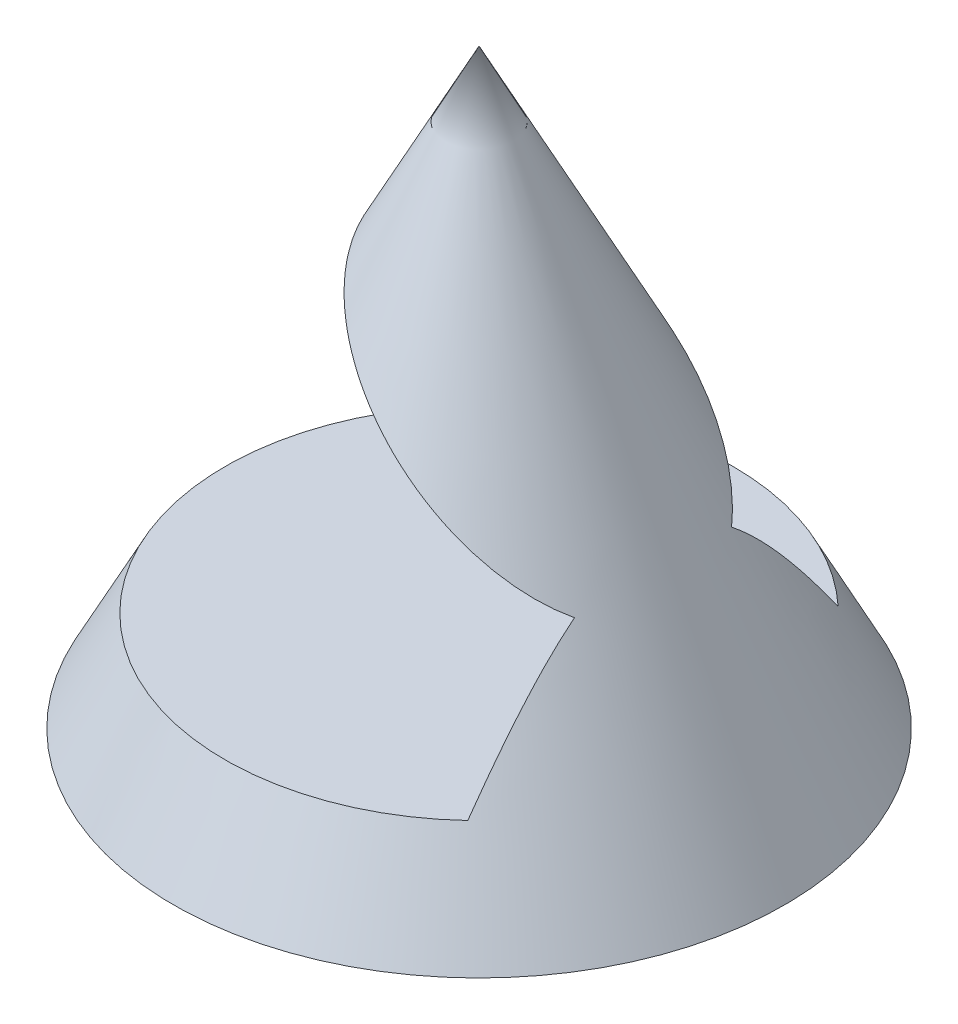
from build123d import *

# Parameters (mm, degrees)
CUT_EXTRUDE_1_DEPTH      = 36.930488446
CUT_EXTRUDE_1_DEPTH_BACK = 36.930488446


with BuildPart() as part:
    # 草图1 → 旋转1 (revolve)
    with BuildSketch(Plane.XY, mode=Mode.PRIVATE) as revolve_1_sk:
        Polygon((0, 0), (0, 29), (15, 0), align=None)
    revolve(revolve_1_sk.sketch.rotate(Axis((0, 0, 0), (0, 1, 0)), 90), axis=Axis((0, 0, 0), (0, 1, 0)))

    # 草图2 → 切除-拉伸1 (cut, two sides: drawn at the far end of the back side and taken through both)
    with BuildSketch(Plane.XY.offset(-CUT_EXTRUDE_1_DEPTH_BACK)):
        Polygon((8.533480566, 4.898062428), (-12.466519434, 4.898062428), (-4.137931034, 21), (8.533480566, 10.898062428), align=None)
    extrude(amount=CUT_EXTRUDE_1_DEPTH + CUT_EXTRUDE_1_DEPTH_BACK, mode=Mode.SUBTRACT)


solid = part.part
